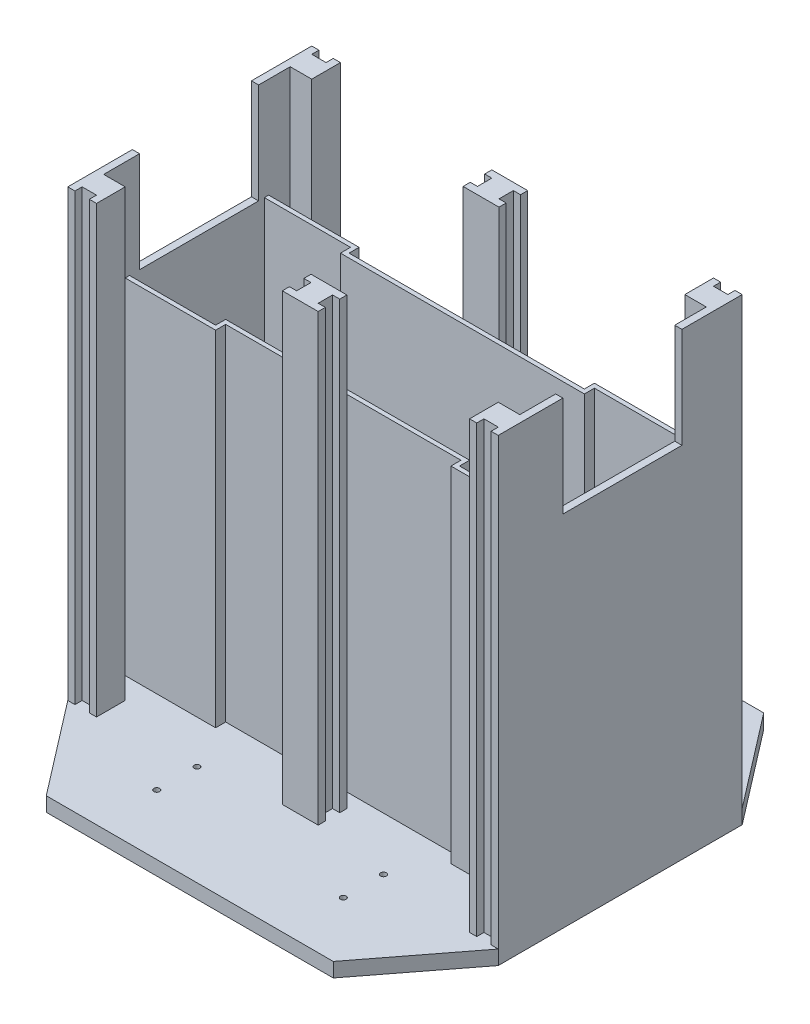
from build123d import *

# Parameters (mm, degrees)
SKETCH1_W               = 35
SKETCH1_H               = 70
BOSS_EXTRUDE1_DEPTH     = 10
BOSS_EXTRUDE3_DEPTH     = 310
BOSS_EXTRUDE4_DEPTH     = 240
SKETCH6_R               = 2
CUT_EXTRUDE1_DEPTH      = 280
LPATTERN1_COUNT         = 2
LPATTERN1_PITCH         = 100
LPATTERN1_COL_COUNT     = 2
LPATTERN1_COL_PITCH     = 100
CUT_EXTRUDE2_DEPTH      = 295
CUT_EXTRUDE2_DEPTH_BACK = 10
SKETCH10_W              = 83
SKETCH10_H              = 70
SKETCH11_W              = 164
SKETCH11_H              = 5
BOSS_EXTRUDE5_DEPTH     = 86


with BuildPart() as part:
    # Sketch1 → Boss-Extrude1 (new body)
    with BuildSketch(Plane(origin=(0, 0, 0), x_dir=(1, 0, 0), z_dir=(0, 1, 0))):
        Polygon((-100, 150), (-150, 85), (-150, -85), (-100, -150), (100, -150), (150, -85), (150, 85), (100, 150), align=None)
        with Locations((-122.5, 0)):
            Rectangle(SKETCH1_W, SKETCH1_H, mode=Mode.SUBTRACT)
        with Locations((122.5, 0)):
            Rectangle(SKETCH1_W, SKETCH1_H, mode=Mode.SUBTRACT)
    extrude(amount=BOSS_EXTRUDE1_DEPTH)

    # Sketch4 → Boss-Extrude3 (add)
    with BuildSketch(Plane(origin=(0, 10, 0), x_dir=(1, 0, 0), z_dir=(0, 1, 0))):
        Polygon((-12.5, -73), (12.5, -73), (12.5, -68), (7.5, -68), (7.5, -58), (12.5, -58), (12.5, -53), (-12.5, -53), (-12.5, -58), (-7.5, -58), (-7.5, -68), (-12.5, -68), align=None)
        Polygon((-150, 85), (-150, -85), (-145, -85), (-145, -80), (-135, -80), (-135, -85), (-130, -85), (-130, -65), (-145, -65), (-145, 65), (-130, 65), (-130, 85), (-135, 85), (-135, 80), (-145, 80), (-145, 85), align=None)
        Polygon((145, 85), (150, 85), (150, -85), (145, -85), (145, -80), (135, -80), (135, -85), (130, -85), (130, -65), (145, -65), (145, 65), (130, 65), (130, 85), (135, 85), (135, 80), (145, 80), align=None)
    boss_extrude3 = extrude(amount=BOSS_EXTRUDE3_DEPTH)

    # Sketch5 → Boss-Extrude4 (add)
    with BuildSketch(Plane(origin=(0, 10, 0), x_dir=(1, 0, 0), z_dir=(0, 1, 0))):
        Polygon((-145, -47), (-85, -47), (-85, -40), (85, -40), (85, -47), (145, -47), (145, -50), (82, -50), (82, -43), (-82, -43), (-82, -50), (-145, -50), align=None)
    boss_extrude4 = extrude(amount=BOSS_EXTRUDE4_DEPTH)

    # Sketch6 → Cut-Extrude1 (cut)
    with BuildSketch(Plane(origin=(0, 10, 0), x_dir=(1, 0, 0), z_dir=(0, 1, 0))):
        with Locations(Location((-65, -80, 0), (0, 0, 270))):
            Circle(SKETCH6_R)
        with Locations(Location((-65, -108, 0), (0, 0, 270))):
            Circle(SKETCH6_R)
        with Locations(Location((65, -108, 0), (0, 0, 90))):
            Circle(SKETCH6_R)
        with Locations(Location((65, -80, 0), (0, 0, 90))):
            Circle(SKETCH6_R)
    cut_extrude1 = extrude(amount=-CUT_EXTRUDE1_DEPTH, mode=Mode.SUBTRACT)

    # Mirror1: Boss-Extrude3, Boss-Extrude4, Cut-Extrude1 across plane
    add(boss_extrude3.mirror(Plane.XY))
    add(boss_extrude4.mirror(Plane.XY))
    add(cut_extrude1.mirror(Plane.XY), mode=Mode.SUBTRACT)

    # Sketch9 → Revolve1 (revolve)
    with BuildSketch(Plane(origin=(0, 0, 0), x_dir=(0, 0, -1), z_dir=(1, 0, 0))):
        with BuildLine():
            Line((117.5, 0), (117.5, -4))
            ThreePointArc((117.5, -4), (120.328427125, -2.828427125), (121.5, 0))
            Line((121.5, 0), (117.5, 0))
        make_face()
    revolve1 = revolve(axis=Axis((0, 0, -117.5), (0, -1, 0)))

    # LPattern1: Revolve1 ×2
    with Locations(*[(-i * LPATTERN1_PITCH, 0, 0) for i in range(1, LPATTERN1_COUNT)]):
        add(revolve1)

    # LPattern1 col: Revolve1 ×2
    with Locations(*[(i * LPATTERN1_COL_PITCH, 0, 0) for i in range(1, LPATTERN1_COL_COUNT)]):
        add(revolve1)

    # Mirror2: Revolve1 across plane
    add(revolve1.mirror(Plane.XY))

    # Mirror2 copy 1 sketch → Mirror2 copy 1 (revolve)
    with BuildSketch(Plane(origin=(-100, 0, 0), x_dir=(0, 0, 1), z_dir=(1, 0, 0))):
        with BuildLine():
            Line((117.5, 0), (117.5, 4))
            ThreePointArc((117.5, 4), (120.328427125, 2.828427125), (121.5, 0))
            Line((121.5, 0), (117.5, 0))
        make_face()
    revolve(axis=Axis((-100, 0, 117.5), (0, 1, 0)))

    # Mirror2 copy 2 sketch → Mirror2 copy 2 (revolve)
    with BuildSketch(Plane(origin=(100, 0, 0), x_dir=(0, 0, 1), z_dir=(1, 0, 0))):
        with BuildLine():
            Line((117.5, 0), (117.5, 4))
            ThreePointArc((117.5, 4), (120.328427125, 2.828427125), (121.5, 0))
            Line((121.5, 0), (117.5, 0))
        make_face()
    revolve(axis=Axis((100, 0, 117.5), (0, 1, 0)))

    # Sketch10 → Cut-Extrude2 (cut, two sides: drawn at the far end of the back side and taken through both)
    with BuildSketch(Plane(origin=(-145, 0, 0), x_dir=(0, 0, -1), z_dir=(1, 0, 0)).offset(-CUT_EXTRUDE2_DEPTH_BACK)):
        with Locations((1.5, 285)):
            Rectangle(SKETCH10_W, SKETCH10_H)
    extrude(amount=CUT_EXTRUDE2_DEPTH + CUT_EXTRUDE2_DEPTH_BACK, mode=Mode.SUBTRACT)

    # Sketch11 → Boss-Extrude5 (add)
    with BuildSketch(Plane.XY.offset(43)):
        with Locations((0, 137.5)):
            Rectangle(SKETCH11_W, SKETCH11_H)
    extrude(amount=-BOSS_EXTRUDE5_DEPTH)


solid = part.part
